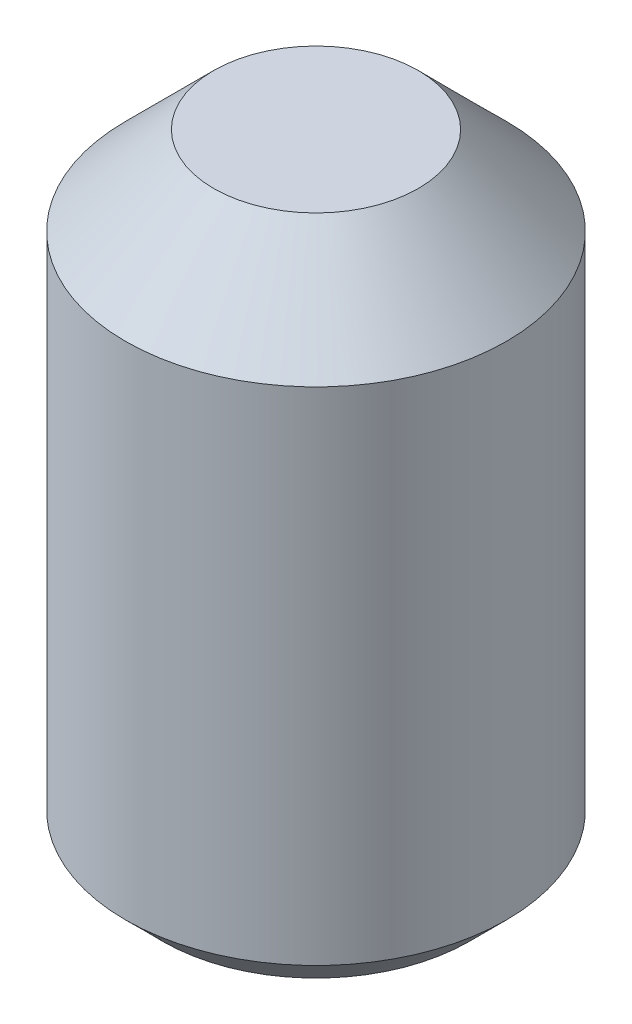
from build123d import *

# Parameters (mm, degrees)
CUT_EXTRUDE1_DEPTH = 2.54
CHAMFER1_SIZE      = 0.47244


with BuildPart() as part:
    # Sketch1 → Revolve1 (revolve)
    with BuildSketch(Plane(origin=(0, 0, 0), x_dir=(-1, 0, 0), z_dir=(0, 0, -1)), mode=Mode.PRIVATE) as revolve1_sk:
        Polygon((-2.413, 0), (0, 0), (0, 7.9375), (-1.2954, 7.9375), (-2.413, 6.8199), align=None)
    revolve(revolve1_sk.sketch.rotate(Axis((0, 0, 0), (0, 1, 0)), 180), axis=Axis((0, 0, 0), (0, 1, 0)))

    # Sketch2 → Cut-Extrude1 (cut)
    with BuildSketch(Plane.XZ):
        Polygon((-0.68704079, 1.189989555), (-1.37408158, 0), (-0.68704079, -1.189989555), (0.68704079, -1.189989555), (1.37408158, 0), (0.68704079, 1.189989555), align=None)
    extrude(amount=-CUT_EXTRUDE1_DEPTH, mode=Mode.SUBTRACT)

    # Chamfer1
    chamfer1_edges = [part.edges().sort_by_distance(p)[0] for p in [
        (2.413, 0, 0),
    ]]
    chamfer(chamfer1_edges, length=CHAMFER1_SIZE)


solid = part.part
